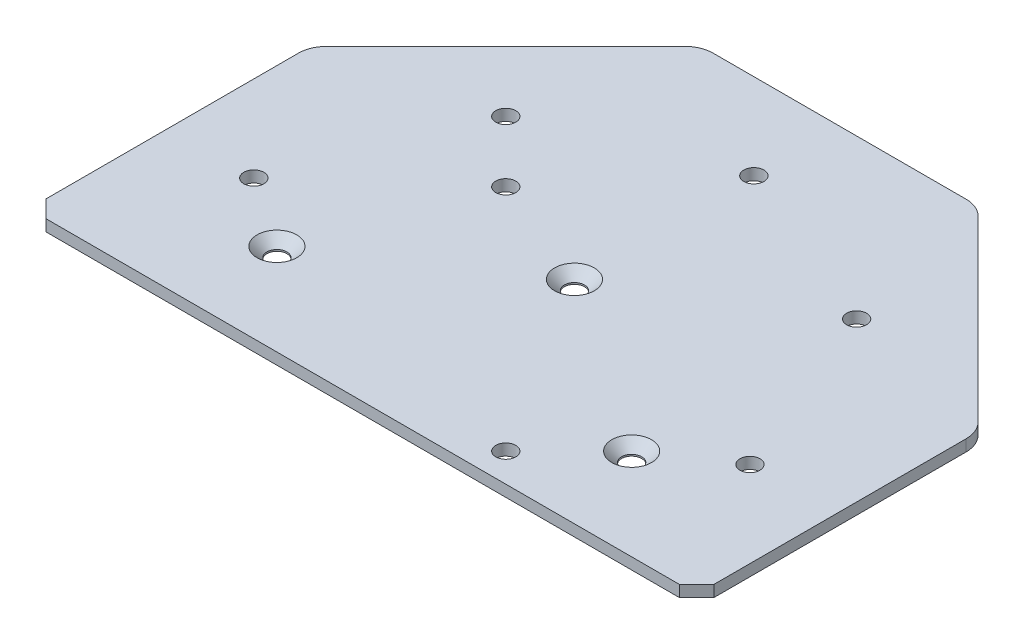
from build123d import *

# Parameters (mm, degrees)
BOSS_EXTRUDE1_DEPTH                          = 2
CUT_EXTRUDE1_REACH                           = 103.772
SKETCH3_R                                    = 1.75
CHAMFER1_SIZE                                = 3
FILLET1_R                                    = 5
CUT_EXTRUDE2_REACH                           = 103.772
SKETCH4_R                                    = 1.75
CUT_EXTRUDE3_REACH                           = 103.772
SKETCH5_R                                    = 1.75
CSK_FOR_M3_HEX_SOCKET_COUNTERSUNK_HE_2_COUNT = 2
CSK_FOR_M3_HEX_SOCKET_COUNTERSUNK_HE_2_PITCH = 37.443290454
CSK_FOR_M3_HEX_SOCKET_COUNTERSUNK_HE_3_COUNT = 2
CSK_FOR_M3_HEX_SOCKET_COUNTERSUNK_HE_3_PITCH = 37.443290454


with BuildPart() as part:
    # Sketch2 → Boss-Extrude1 (new body)
    with BuildSketch(Plane(origin=(0, 0, 0), x_dir=(1, 0, 0), z_dir=(0, 1, 0))):
        Polygon((-58.355339059, 0), (58.355339059, 0), (58.355339059, 49.171572875), (24.171572875, 83.355339059), (-24.171572875, 83.355339059), (-58.355339059, 49.171572875), align=None)
    extrude(amount=BOSS_EXTRUDE1_DEPTH)

    # Sketch3 → Cut-Extrude1 (cut, up to next)
    with BuildSketch(Plane.XZ, mode=Mode.PRIVATE) as cut_extrude1_sk1:
        with Locations(Location((-43.355339059, -24.315188388, 0), (0, 0, 270))):
            Circle(SKETCH3_R)
    cut_extrude1_tool1 = extrude(cut_extrude1_sk1.sketch, amount=-CUT_EXTRUDE1_REACH, mode=Mode.PRIVATE) & part.part
    # Sketch3 → Cut-Extrude1 (cut, up to next)
    with BuildSketch(Plane.XZ, mode=Mode.PRIVATE) as cut_extrude1_sk2:
        with Locations(Location((-30.656854249, -55.656854249, 0), (0, 0, 270))):
            Circle(SKETCH3_R)
    cut_extrude1_tool2 = extrude(cut_extrude1_sk2.sketch, amount=-CUT_EXTRUDE1_REACH, mode=Mode.PRIVATE) & part.part
    # Sketch3 → Cut-Extrude1 (cut, up to next)
    with BuildSketch(Plane.XZ, mode=Mode.PRIVATE) as cut_extrude1_sk3:
        with Locations(Location((0, -68.355339059, 0), (0, 0, 270))):
            Circle(SKETCH3_R)
    cut_extrude1_tool3 = extrude(cut_extrude1_sk3.sketch, amount=-CUT_EXTRUDE1_REACH, mode=Mode.PRIVATE) & part.part
    # Sketch3 → Cut-Extrude1 (cut, up to next)
    with BuildSketch(Plane.XZ, mode=Mode.PRIVATE) as cut_extrude1_sk4:
        with Locations(Location((30.656854249, -55.656854249, 0), (0, 0, 270))):
            Circle(SKETCH3_R)
    cut_extrude1_tool4 = extrude(cut_extrude1_sk4.sketch, amount=-CUT_EXTRUDE1_REACH, mode=Mode.PRIVATE) & part.part
    # Sketch3 → Cut-Extrude1 (cut, up to next)
    with BuildSketch(Plane.XZ, mode=Mode.PRIVATE) as cut_extrude1_sk5:
        with Locations(Location((43.355339059, -24.315188388, 0), (0, 0, 270))):
            Circle(SKETCH3_R)
    cut_extrude1_tool5 = extrude(cut_extrude1_sk5.sketch, amount=-CUT_EXTRUDE1_REACH, mode=Mode.PRIVATE) & part.part
    add(cut_extrude1_tool1.solids().sort_by_distance((-43.355339, 0, -24.315188))[0], mode=Mode.SUBTRACT)
    add(cut_extrude1_tool2.solids().sort_by_distance((-30.656854, 0, -55.656854))[0], mode=Mode.SUBTRACT)
    add(cut_extrude1_tool3.solids().sort_by_distance((0, 0, -68.355339))[0], mode=Mode.SUBTRACT)
    add(cut_extrude1_tool4.solids().sort_by_distance((30.656854, 0, -55.656854))[0], mode=Mode.SUBTRACT)
    add(cut_extrude1_tool5.solids().sort_by_distance((43.355339, 0, -24.315188))[0], mode=Mode.SUBTRACT)

    # Chamfer1
    chamfer1_edges = [part.edges().sort_by_distance(p)[0] for p in [
        (58.355339059, 1, 0),
        (-58.355339059, 1, 0),
    ]]
    chamfer(chamfer1_edges, length=CHAMFER1_SIZE)

    # Fillet1
    fillet1_edges = [part.edges().sort_by_distance(p)[0] for p in [
        (-58.355339059, 1, -49.171572875),
        (-24.171572875, 1, -83.355339059),
        (24.171572875, 1, -83.355339059),
        (58.355339059, 1, -49.171572875),
    ]]
    fillet(fillet1_edges, radius=FILLET1_R)

    # Sketch4 → Cut-Extrude2 (cut, up to next)
    with BuildSketch(Plane(origin=(0, 2, 0), x_dir=(1, 0, 0), z_dir=(0, 1, 0)), mode=Mode.PRIVATE) as cut_extrude2_sk1:
        with Locations(Location((-20, 45, 0), (0, 0, 270))):
            Circle(SKETCH4_R)
    cut_extrude2_tool1 = extrude(cut_extrude2_sk1.sketch, amount=-CUT_EXTRUDE2_REACH, mode=Mode.PRIVATE) & part.part
    # Sketch4 → Cut-Extrude2 (cut, up to next)
    with BuildSketch(Plane(origin=(0, 2, 0), x_dir=(1, 0, 0), z_dir=(0, 1, 0)), mode=Mode.PRIVATE) as cut_extrude2_sk2:
        with Locations(Location((20, 5, 0), (0, 0, 270))):
            Circle(SKETCH4_R)
    cut_extrude2_tool2 = extrude(cut_extrude2_sk2.sketch, amount=-CUT_EXTRUDE2_REACH, mode=Mode.PRIVATE) & part.part
    add(cut_extrude2_tool1.solids().sort_by_distance((-20, 2, -45))[0], mode=Mode.SUBTRACT)
    add(cut_extrude2_tool2.solids().sort_by_distance((20, 2, -5))[0], mode=Mode.SUBTRACT)

    # Sketch5 → Cut-Extrude3 (cut, up to next)
    with BuildSketch(Plane(origin=(0, 2, 0), x_dir=(1, 0, 0), z_dir=(0, 1, 0)), mode=Mode.PRIVATE) as cut_extrude3_sk1:
        with Locations(Location((0, 37, 0), (0, 0, 270))):
            Circle(SKETCH5_R)
    cut_extrude3_tool1 = extrude(cut_extrude3_sk1.sketch, amount=-CUT_EXTRUDE3_REACH, mode=Mode.PRIVATE) & part.part
    # Sketch5 → Cut-Extrude3 (cut, up to next)
    with BuildSketch(Plane(origin=(0, 2, 0), x_dir=(1, 0, 0), z_dir=(0, 1, 0)), mode=Mode.PRIVATE) as cut_extrude3_sk2:
        with Locations(Location((-31, 16, 0), (0, 0, 270))):
            Circle(SKETCH5_R)
    cut_extrude3_tool2 = extrude(cut_extrude3_sk2.sketch, amount=-CUT_EXTRUDE3_REACH, mode=Mode.PRIVATE) & part.part
    # Sketch5 → Cut-Extrude3 (cut, up to next)
    with BuildSketch(Plane(origin=(0, 2, 0), x_dir=(1, 0, 0), z_dir=(0, 1, 0)), mode=Mode.PRIVATE) as cut_extrude3_sk3:
        with Locations(Location((31, 16, 0), (0, 0, 270))):
            Circle(SKETCH5_R)
    cut_extrude3_tool3 = extrude(cut_extrude3_sk3.sketch, amount=-CUT_EXTRUDE3_REACH, mode=Mode.PRIVATE) & part.part
    add(cut_extrude3_tool1.solids().sort_by_distance((0, 2, -37))[0], mode=Mode.SUBTRACT)
    add(cut_extrude3_tool2.solids().sort_by_distance((-31, 2, -16))[0], mode=Mode.SUBTRACT)
    add(cut_extrude3_tool3.solids().sort_by_distance((31, 2, -16))[0], mode=Mode.SUBTRACT)

    # Sketch6 → CSK for M3 Hex Socket Countersunk Head Screw1 (revolve, cut)
    with BuildSketch(Plane(origin=(0, 2, -37), x_dir=(0, 0, 1), z_dir=(1, 0, 0))):
        Polygon((0, 0), (0, 2), (1.7, 2), (1.7, 1.77), (3.47, 0), align=None)
    csk_for_m3_hex_socket_countersunk_head_s = revolve(axis=Axis((0, 8.35, -37), (0, -1, 0)), mode=Mode.SUBTRACT)

    # CSK for M3 Hex Socket Countersunk He 2: CSK for M3 Hex Socket Countersunk Head Screw1 ×2
    with Locations(*[Vector(-0.827918690488332, 0, 0.5608481451695153) * (i * CSK_FOR_M3_HEX_SOCKET_COUNTERSUNK_HE_2_PITCH) for i in range(1, CSK_FOR_M3_HEX_SOCKET_COUNTERSUNK_HE_2_COUNT)]):
        add(csk_for_m3_hex_socket_countersunk_head_s, mode=Mode.SUBTRACT)

    # CSK for M3 Hex Socket Countersunk He 3: CSK for M3 Hex Socket Countersunk Head Screw1 ×2
    with Locations(*[Vector(0.827918690488332, 0, 0.5608481451695153) * (i * CSK_FOR_M3_HEX_SOCKET_COUNTERSUNK_HE_3_PITCH) for i in range(1, CSK_FOR_M3_HEX_SOCKET_COUNTERSUNK_HE_3_COUNT)]):
        add(csk_for_m3_hex_socket_countersunk_head_s, mode=Mode.SUBTRACT)


solid = part.part
